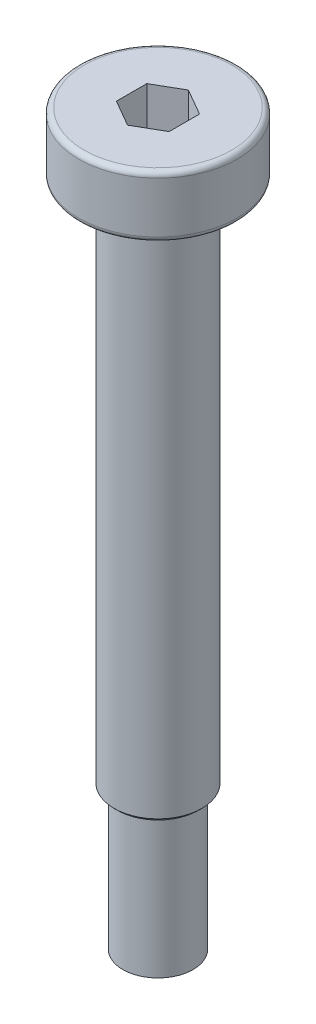
from build123d import *

# Parameters (mm, degrees)
FILLET_1_R          = 0.3
CUT_EXTRUDE_1_DEPTH = 2.4
CHAMFER_1_SIZE      = 0.2


with BuildPart() as part:
    # 草图1 → 旋转1 (revolve)
    with BuildSketch(Plane.XY, mode=Mode.PRIVATE) as revolve_1_sk:
        Polygon((0, 9.61644491), (-4.5, 9.61644491), (-4.5, 6.11644491), (-2.5, 6.11644491), (-2.5, -23.88355509), (-2, -23.88355509), (-2, -31.88355509), (0, -31.88355509), align=None)
    revolve(revolve_1_sk.sketch.rotate(Axis((0, 13.292915498, 0), (0, -1, 0)), 270), axis=Axis((0, 13.292915498, 0), (0, -1, 0)))

    # 圆角1
    fillet_1_edges = [part.edges().sort_by_distance(p)[0] for p in [
        (0, 6.11644491, -4.5),
        (0, 9.61644491, -4.5),
    ]]
    fillet(fillet_1_edges, radius=FILLET_1_R)

    # 草图2 → 切除-拉伸1 (cut)
    with BuildSketch(Plane(origin=(0, 9.61644491, 0), x_dir=(1, 0, 0), z_dir=(0, 1, 0))):
        Polygon((1.5, 0.866025404), (0, 1.732050808), (-1.5, 0.866025404), (-1.5, -0.866025404), (0, -1.732050808), (1.5, -0.866025404), align=None)
    extrude(amount=-CUT_EXTRUDE_1_DEPTH, mode=Mode.SUBTRACT)

    # 倒角1
    chamfer_1_edges = [part.edges().sort_by_distance(p)[0] for p in [
        (0, -23.88355509, -2.5),
    ]]
    chamfer(chamfer_1_edges, length=CHAMFER_1_SIZE)


solid = part.part
